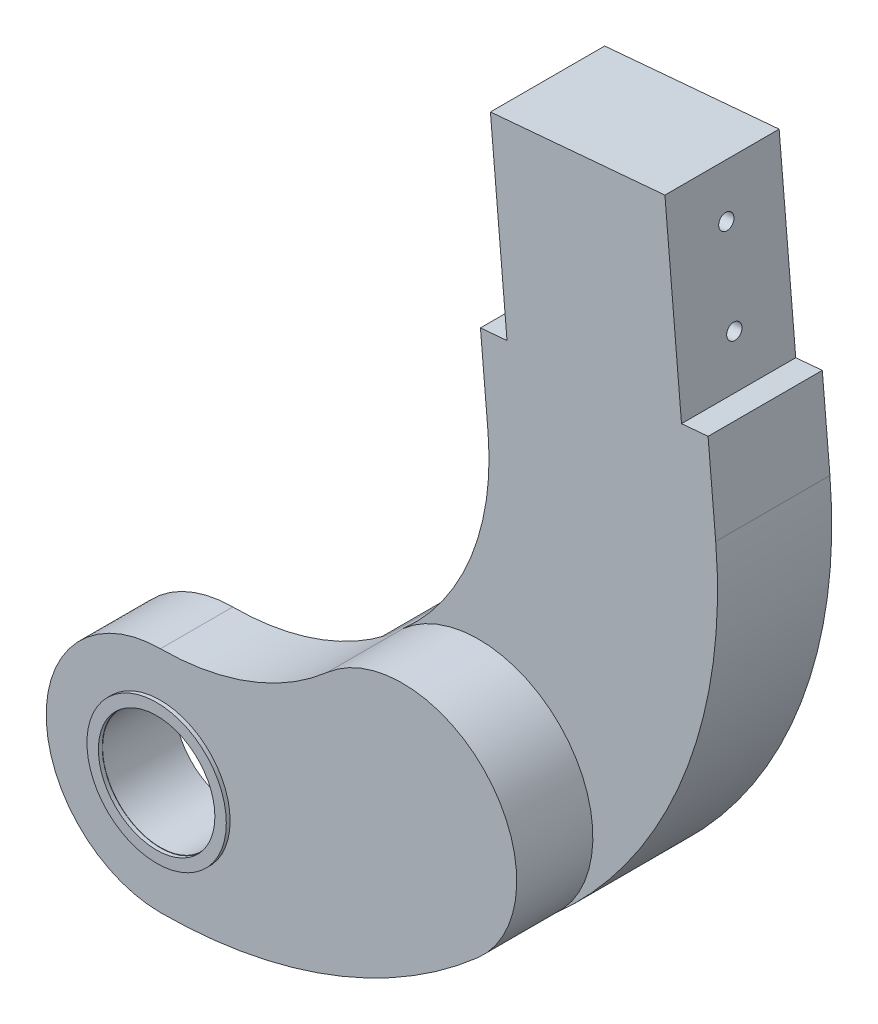
from build123d import *

# Parameters (mm, degrees)
SKETCH_396_R           = 7.6
EXTRUDE_924_DEPTH      = 15
CUT_EXTRUDE_1360_DEPTH = 10
SKETCH_1871_R          = 7.6
EXTRUDE_2829_DEPTH     = 10
SKETCH_2885_R          = 7.6
CUT_EXTRUDE_3705_DEPTH = 15.5
SKETCH_7625_R          = 9.15
SKETCH_7625_R_2        = 7.65
EXTRUDE_7744_DEPTH     = 0.5


with BuildPart() as part:
    # Sketch 396 → Extrude 924 (new body)
    with BuildSketch(Plane.XY):
        with BuildLine():
            Line((33.023854242, 2.889212872), (32.0215632, 14.3454519))
            Line((32.0215632, 14.3454519), (35.508244643, 14.650497))
            Line((35.508244643, 14.650497), (33.329351075, 39.555364452))
            Line((33.329351075, 39.555364452), (56.241829131, 41.559946535))
            Line((56.241829131, 41.559946535), (58.4207227, 16.655079083))
            Line((58.4207227, 16.655079083), (61.907404143, 16.960124183))
            Line((61.907404143, 16.960124183), (62.909695184, 5.503885155))
            ThreePointArc((62.909695184, 5.503885155), (46.55906382, -42.663521611), (0, -63.15))
            ThreePointArc((0, -63.15), (-15, -48.15), (0, -33.15))
            ThreePointArc((0, -33.15), (24.440743715, -22.395815382), (33.023854242, 2.889212872))
        make_face()
        with Locations((0, -48.15)):
            Circle(SKETCH_396_R, mode=Mode.SUBTRACT)
    extrude(amount=EXTRUDE_924_DEPTH)

    # Sketch 979 → Cut-Extrude 1360 (cut)
    with BuildSketch(Plane(origin=(62.909695184, 5.503885155, 0), x_dir=(0, 0, -1), z_dir=(0.9961946980917458, 0.08715574274765542, 0))):
        with BuildLine():
            ThreePointArc((-6.5, 30), (-6.792893219, 30.707106781), (-7.5, 31))
            Line((-7.5, 31), (-7.5, 29))
            ThreePointArc((-7.5, 29), (-6.792893219, 29.292893219), (-6.5, 30))
        make_face()
        with BuildLine():
            Line((-7.5, 29), (-7.5, 31))
            ThreePointArc((-7.5, 31), (-8.5, 30), (-7.5, 29))
        make_face()
        with BuildLine():
            ThreePointArc((-6.5, 18), (-6.792893219, 18.707106781), (-7.5, 19))
            Line((-7.5, 19), (-7.5, 17))
            ThreePointArc((-7.5, 17), (-6.792893219, 17.292893219), (-6.5, 18))
        make_face()
        with BuildLine():
            Line((-7.5, 17), (-7.5, 19))
            ThreePointArc((-7.5, 19), (-8.5, 18), (-7.5, 17))
        make_face()
    cut_extrude_1360 = extrude(amount=-CUT_EXTRUDE_1360_DEPTH, mode=Mode.SUBTRACT)

    # Mirror 1436: Cut-Extrude 1360 across plane
    add(cut_extrude_1360.mirror(Plane(origin=(47.966774713, 4.196549013, 0), x_dir=(0, 0, 1), z_dir=(0.9961946980917455, 0.0871557427476578, 0))), mode=Mode.SUBTRACT)

    # Sketch 1871 → Extrude 2829 (add)
    with BuildSketch(Plane.XY.offset(15)):
        with BuildLine():
            ThreePointArc((0, -63.15), (22.275075929, -59.090976404), (41.686650392, -47.43570047))
            ThreePointArc((41.686650392, -47.43570047), (43.052220482, -26.26649599), (21.883016002, -24.9009259))
            ThreePointArc((21.883016002, -24.9009259), (11.693092115, -31.019253647), (0, -33.15))
            ThreePointArc((0, -33.15), (-15, -48.15), (0, -63.15))
        make_face()
        with Locations((0, -48.15)):
            Circle(SKETCH_1871_R, mode=Mode.SUBTRACT)
    extrude(amount=EXTRUDE_2829_DEPTH)

    # Sketch 2885 → Cut-Extrude 3705 (cut)
    with BuildSketch(Plane(origin=(0, 0, 0), x_dir=(-1, 0, 0), z_dir=(0, 0, -1))):
        with BuildLine():
            ThreePointArc((0, -63.15), (15, -48.15), (0, -33.15))
            ThreePointArc((0, -33.15), (-10.671339307, -31.385426831), (-20.206608689, -26.279563643))
            ThreePointArc((-20.206608689, -26.279563643), (-17.458666259, -47.314030755), (-38.493133336, -50.061973453))
            ThreePointArc((-38.493133336, -50.061973453), (-20.328660512, -59.788527844), (0, -63.15))
        make_face()
        with Locations((0, -48.15)):
            Circle(SKETCH_2885_R, mode=Mode.SUBTRACT)
    extrude(amount=-CUT_EXTRUDE_3705_DEPTH, mode=Mode.SUBTRACT)

    # Sketch 7625 → Extrude 7744 (add)
    with BuildSketch(Plane.XY.offset(25)):
        with Locations((0, -48.15)):
            Circle(SKETCH_7625_R)
        with Locations((0, -48.15)):
            Circle(SKETCH_7625_R_2, mode=Mode.SUBTRACT)
    extrude(amount=EXTRUDE_7744_DEPTH)


solid = part.part
